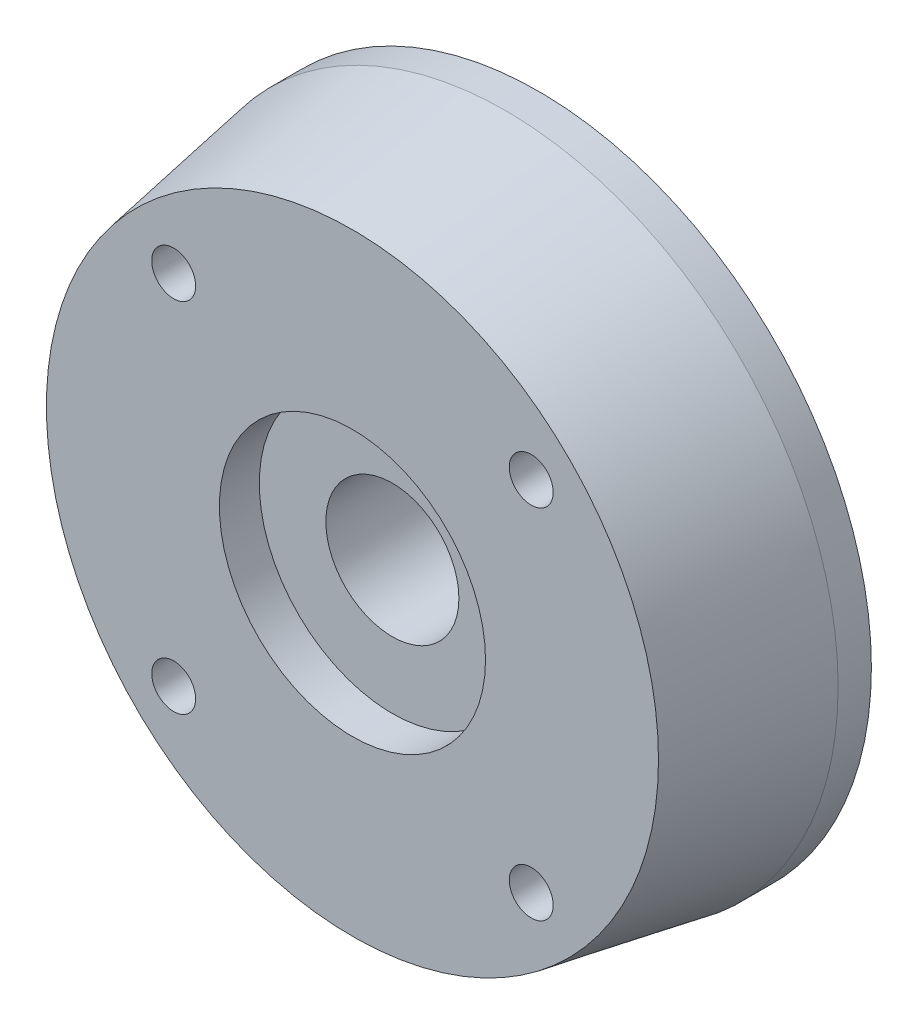
from build123d import *

# Parameters (mm, degrees)
SKETCH_1_R               = 25
EXTRUDE_1_DEPTH          = 14
SKETCH_3_R               = 1.5
CUT_EXTRUDE_1_DEPTH      = 2
HOLE_WIZARD_M4_1_D       = 3.3
PATTERN_CIRCULAR_1_COUNT = 4
SKETCH_5_R               = 10
CUT_EXTRUDE_2_DEPTH      = 3
SKETCH_6_R               = 5
CUT_EXTRUDE_3_DEPTH      = 38.027017163


with BuildPart() as part:
    # 草图1 → 凸台-拉伸1 (new body)
    with BuildSketch(Plane.XY):
        Circle(SKETCH_1_R)
    extrude(amount=EXTRUDE_1_DEPTH)

    # 草图2 → 切除-旋转1 (revolve, cut)
    with BuildSketch(Plane(origin=(0, 0, 0), x_dir=(0, 0, -1), z_dir=(1, 0, 0)), mode=Mode.PRIVATE) as cut_revolve_1_sk:
        Polygon((-14, 25), (-2.5, 25), (-14, 23), align=None)
    revolve(cut_revolve_1_sk.sketch.rotate(Axis((0, 0, 0), (0, 0, -1)), 90), axis=Axis((0, 0, 0), (0, 0, -1)), mode=Mode.SUBTRACT)

    # 草图3 → 切除-拉伸1 (cut)
    with BuildSketch(Plane.XY.offset(14)):
        with Locations((13.435028843, 13.435028843)):
            Circle(SKETCH_3_R)
    extrude(amount=-CUT_EXTRUDE_1_DEPTH, mode=Mode.SUBTRACT)

    # M4 螺纹孔1 (through all)
    with Locations(Plane(origin=(13.435028843, 13.435028843, 14), x_dir=(1, 0, 0), z_dir=(0, 0, 1))):
        with Locations((0, 0)):
            hole_wizard_m4_1 = Hole(HOLE_WIZARD_M4_1_D / 2)

    # 阵列(圆周)1: M4 螺纹孔1 ×4 about axis
    pattern_circular_1_axis = Axis((0, 0, 0), (0, 0, 1))
    for i in range(1, PATTERN_CIRCULAR_1_COUNT):
        add(hole_wizard_m4_1.rotate(pattern_circular_1_axis, i * 360 / PATTERN_CIRCULAR_1_COUNT), mode=Mode.SUBTRACT)

    # 草图5 → 切除-拉伸2 (cut)
    with BuildSketch(Plane.XY.offset(14)):
        Circle(SKETCH_5_R)
    extrude(amount=-CUT_EXTRUDE_2_DEPTH, mode=Mode.SUBTRACT)

    # 草图6 → 切除-拉伸3 (cut, through all)
    with BuildSketch(Plane.XY.offset(11)):
        Circle(SKETCH_6_R)
    extrude(amount=-CUT_EXTRUDE_3_DEPTH, mode=Mode.SUBTRACT)


solid = part.part
